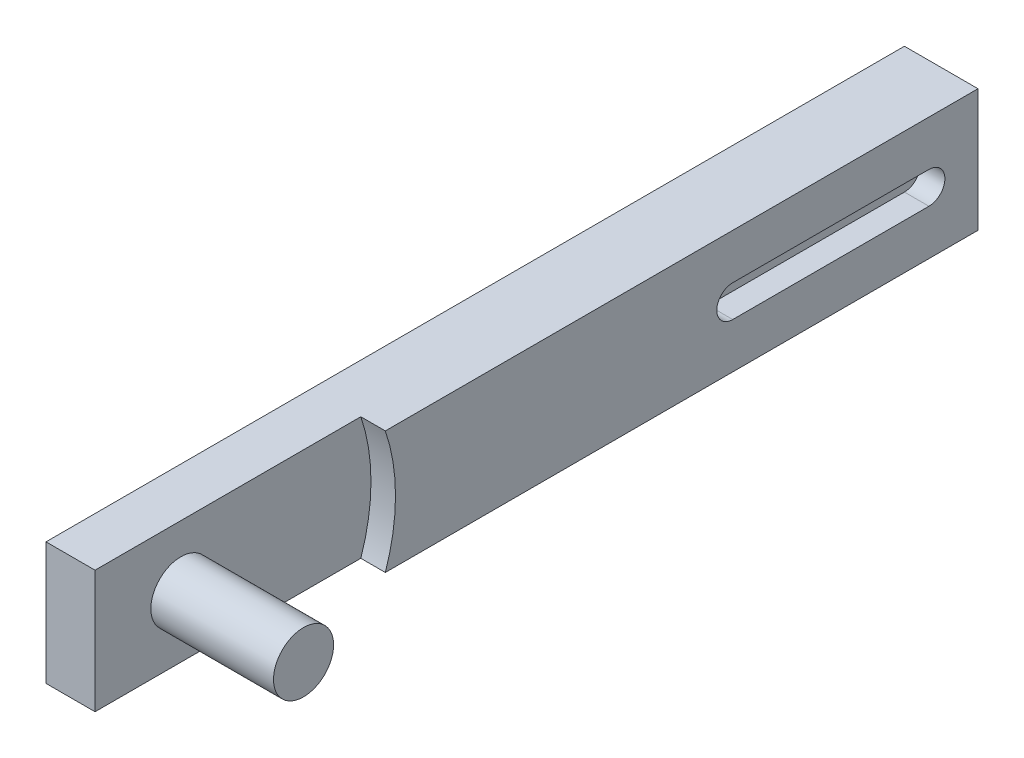
from build123d import *

# Parameters (mm, degrees)
SKETCH1_W           = 350
SKETCH1_H           = 50
BOSS_EXTRUDE1_DEPTH = 30
CUT_EXTRUDE1_DEPTH  = 10
SKETCH3_R           = 77.5
CUT_EXTRUDE2_DEPTH  = 10
SKETCH4_R           = 12.25
BOSS_EXTRUDE2_DEPTH = 50


with BuildPart() as part:
    # Sketch1 → Boss-Extrude1 (new body)
    with BuildSketch(Plane(origin=(0, 0, 0), x_dir=(0, 0, -1), z_dir=(1, 0, 0))):
        Rectangle(SKETCH1_W, SKETCH1_H)
    extrude(amount=BOSS_EXTRUDE1_DEPTH)

    # Sketch2 → Cut-Extrude1 (cut)
    with BuildSketch(Plane(origin=(30, 0, 0), x_dir=(0, 0, -1), z_dir=(1, 0, 0))):
        with BuildLine():
            Line((155, -6.5), (75, -6.5))
            ThreePointArc((75, -6.5), (68.5, 0), (75, 6.5))
            Line((75, 6.5), (155, 6.5))
            ThreePointArc((155, 6.5), (161.5, 0), (155, -6.5))
        make_face()
    extrude(amount=-CUT_EXTRUDE1_DEPTH, mode=Mode.SUBTRACT)

    # Sketch3 → Cut-Extrude2 (cut)
    with BuildSketch(Plane(origin=(30, 0, 0), x_dir=(0, 0, -1), z_dir=(1, 0, 0))):
        with Locations((-140, 0)):
            Circle(SKETCH3_R)
    extrude(amount=-CUT_EXTRUDE2_DEPTH, mode=Mode.SUBTRACT)

    # Sketch4 → Boss-Extrude2 (add)
    with BuildSketch(Plane(origin=(20, 0, 0), x_dir=(0, 0, -1), z_dir=(1, 0, 0))):
        with Locations((-140, 0)):
            Circle(SKETCH4_R)
    extrude(amount=BOSS_EXTRUDE2_DEPTH)


solid = part.part
